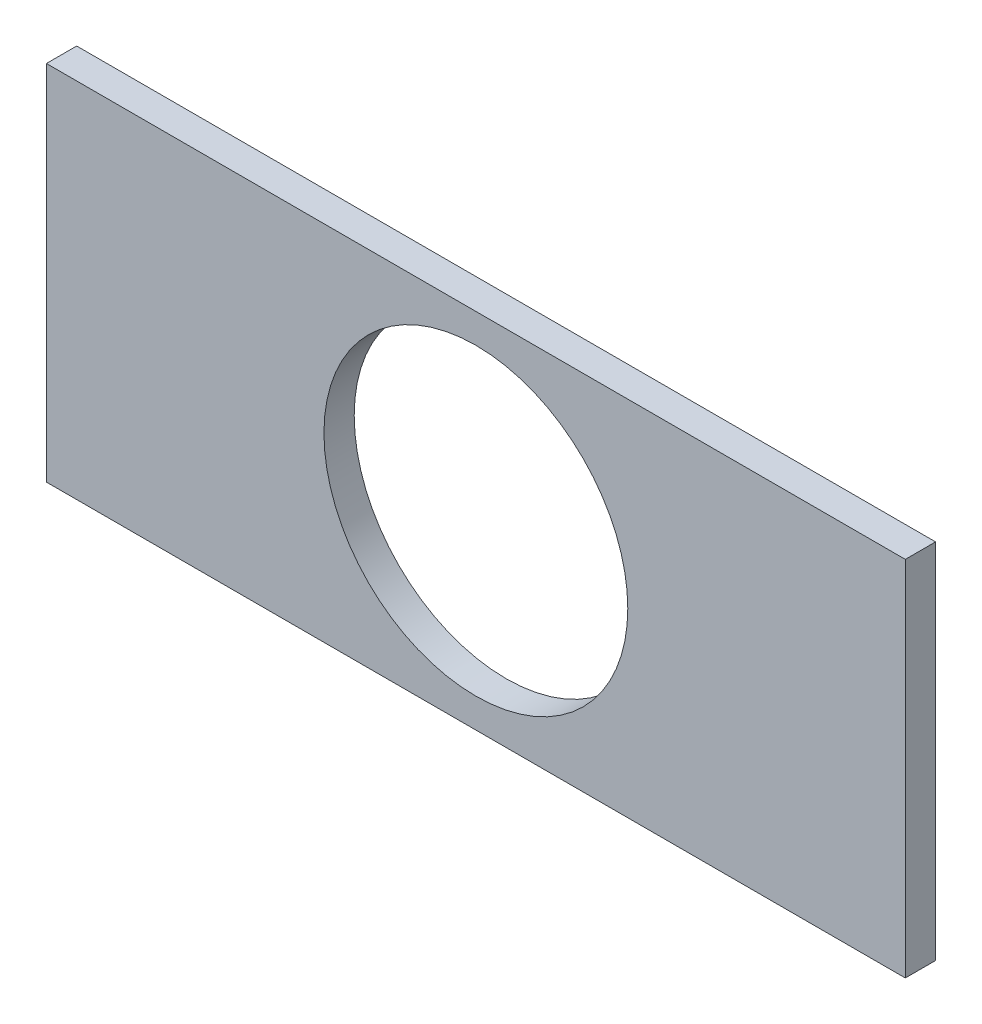
from build123d import *

# Parameters (mm, degrees)
SKETCH1_W           = 180.213
SKETCH1_H           = 76.073
BOSS_EXTRUDE1_DEPTH = 6.35
SKETCH4_R           = 31.877
CUT_EXTRUDE1_DEPTH  = 196.714458326


with BuildPart() as part:
    # Sketch1 → Boss-Extrude1 (new body)
    with BuildSketch(Plane.XY):
        with Locations((90.1065, 38.0365)):
            Rectangle(SKETCH1_W, SKETCH1_H)
    extrude(amount=BOSS_EXTRUDE1_DEPTH)

    # Sketch4 → Cut-Extrude1 (cut, through all)
    with BuildSketch(Plane.XY.offset(6.35)):
        with Locations((90.1065, 38.0365)):
            Circle(SKETCH4_R)
    extrude(amount=-CUT_EXTRUDE1_DEPTH, mode=Mode.SUBTRACT)


solid = part.part
